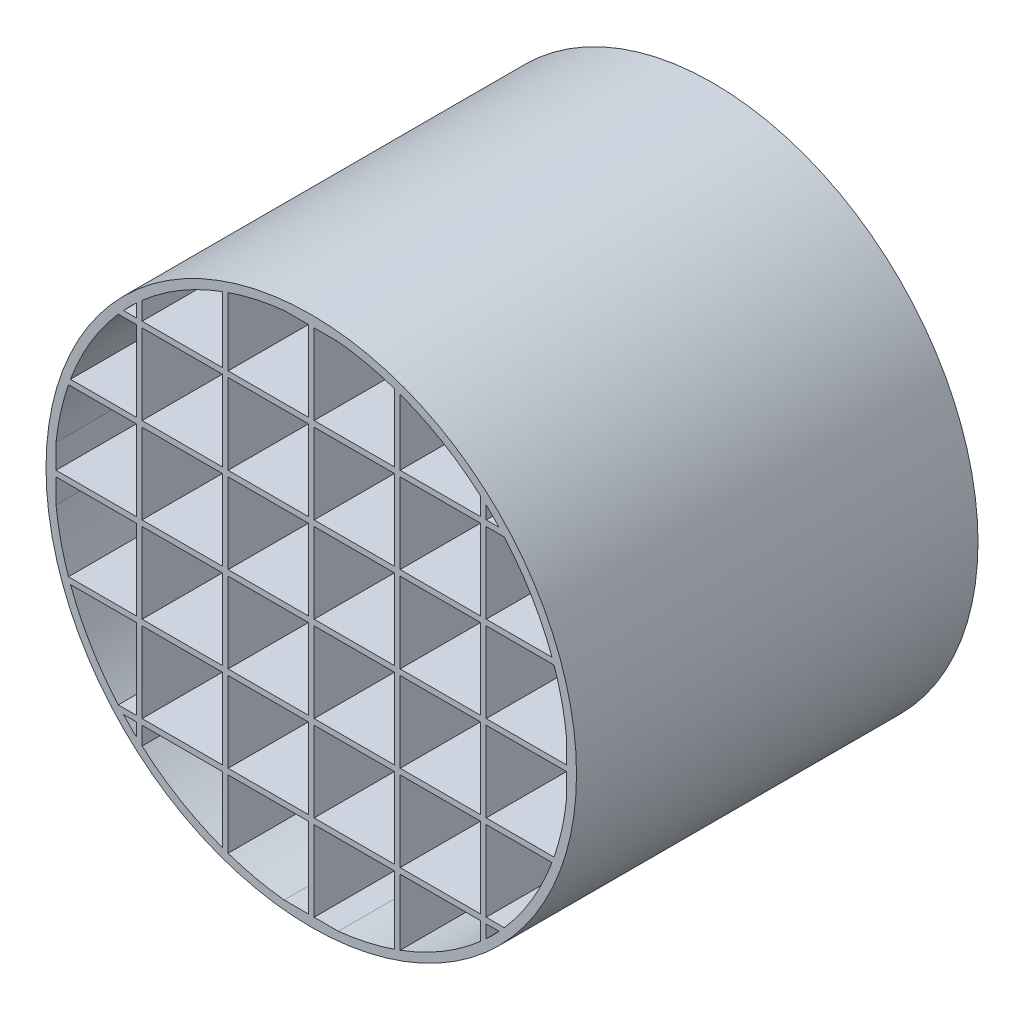
from build123d import *

# Parameters (mm, degrees)
SKETCH_7_W               = 400
SKETCH_7_H               = 400
EXTRUDE_1_DEPTH          = 3
SKETCH_8_W               = 380
SKETCH_8_H               = 2
EXTRUDE_2_DEPTH          = 140
SKETCH_9_W               = 2
SKETCH_9_H               = 382
EXTRUDE_3_DEPTH          = 140
PATTERN_LINEAR_1_COUNT   = 12
PATTERN_LINEAR_1_PITCH   = 30
PATTERN_LINEAR_3_COUNT   = 12
PATTERN_LINEAR_3_PITCH   = 30
SKETCH_11_W              = 400
SKETCH_11_H              = 400
CUT_EXTRUDE_1_DEPTH      = 3
CUT_EXTRUDE_2_DEPTH      = 570.034269618
CUT_EXTRUDE_2_DEPTH_BACK = 570.034269618
SKETCH_12_R              = 300
SKETCH_12_R_2            = 90
SKETCH_13_R              = 92.5
SKETCH_13_R_2            = 89.5
EXTRUDE_8_DEPTH          = 140


with BuildPart() as part:
    # 草图7 → 凸台-拉伸1 (new body)
    with BuildSketch(Plane.XY):
        with Locations((200, 200)):
            Rectangle(SKETCH_7_W, SKETCH_7_H)
    extrude(amount=EXTRUDE_1_DEPTH)

    # 草图8 → 凸台-拉伸2 (add)
    with BuildSketch(Plane.XY.offset(3)):
        with Locations((200, 389)):
            Rectangle(SKETCH_8_W, SKETCH_8_H)
    extrude_2 = extrude(amount=EXTRUDE_2_DEPTH)

    # 草图9 → 凸台-拉伸3 (add)
    with BuildSketch(Plane.XY.offset(3)):
        with Locations((11, 199)):
            Rectangle(SKETCH_9_W, SKETCH_9_H)
    extrude_3 = extrude(amount=EXTRUDE_3_DEPTH)

    # 阵列(线性)1: 凸台-拉伸3 ×12
    with Locations(*[(i * PATTERN_LINEAR_1_PITCH, 0, 0) for i in range(1, PATTERN_LINEAR_1_COUNT)]):
        add(extrude_3)

    # 阵列(线性)3: 凸台-拉伸2 ×12
    with Locations(*[(0, -i * PATTERN_LINEAR_3_PITCH, 0) for i in range(1, PATTERN_LINEAR_3_COUNT)]):
        add(extrude_2)

    # 草图11 → 切除-拉伸1 (cut)
    with BuildSketch(Plane(origin=(0, 0, 0), x_dir=(-1, 0, 0), z_dir=(0, 0, -1))):
        with Locations((-200, 200)):
            Rectangle(SKETCH_11_W, SKETCH_11_H)
    extrude(amount=-CUT_EXTRUDE_1_DEPTH, mode=Mode.SUBTRACT)

    # 草图12 → 切除-拉伸2 (cut, two sides: drawn at the far end of the back side and taken through both)
    with BuildSketch(Plane(origin=(0, 0, 3), x_dir=(-1, 0, 0), z_dir=(0, 0, -1)).offset(-CUT_EXTRUDE_2_DEPTH_BACK)):
        with Locations((-191, 208.958405787)):
            Circle(SKETCH_12_R)
        with Locations((-191, 208.958405787)):
            Circle(SKETCH_12_R_2, mode=Mode.SUBTRACT)
    extrude(amount=CUT_EXTRUDE_2_DEPTH + CUT_EXTRUDE_2_DEPTH_BACK, mode=Mode.SUBTRACT)

    # 草图13 → 凸台-拉伸8 (add)
    with BuildSketch(Plane(origin=(0, 0, 3), x_dir=(-1, 0, 0), z_dir=(0, 0, -1))):
        with Locations((-191, 209)):
            Circle(SKETCH_13_R)
        with Locations((-191, 209)):
            Circle(SKETCH_13_R_2, mode=Mode.SUBTRACT)
    extrude(amount=-EXTRUDE_8_DEPTH)


solid = part.part
